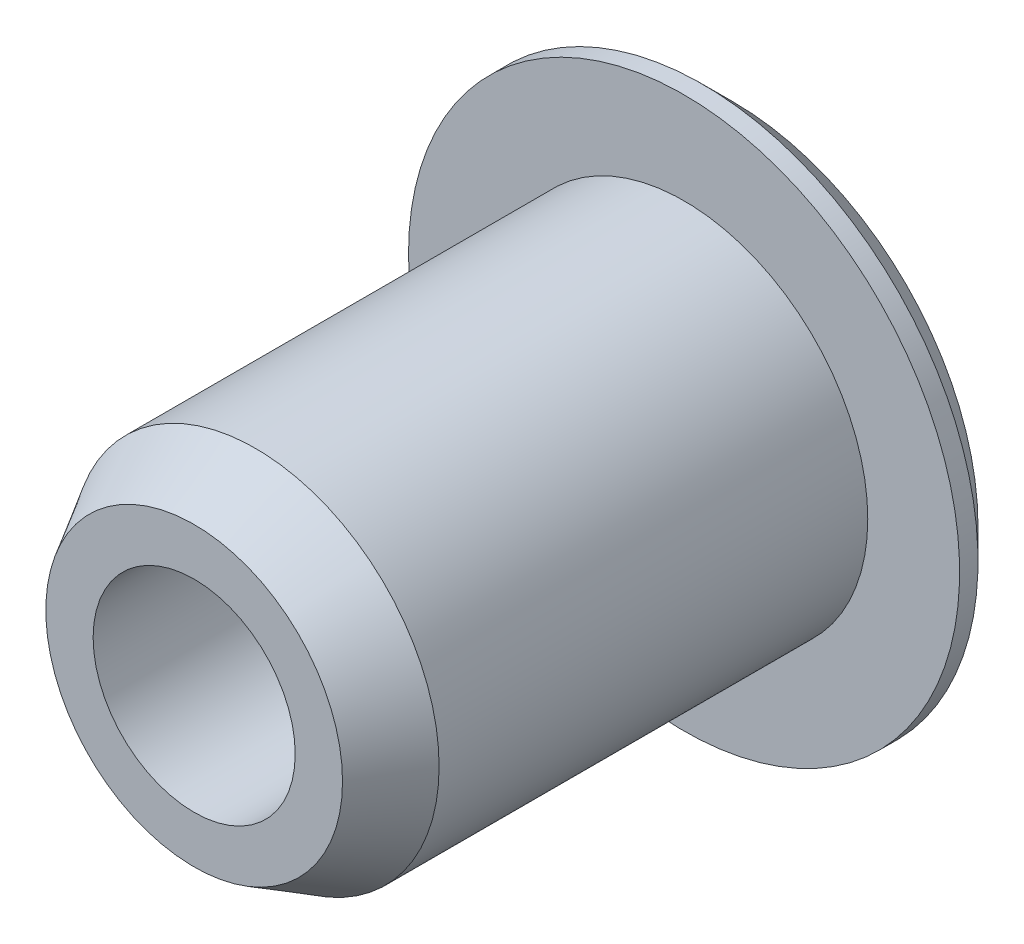
from build123d import *
from build123d.topology import SkipClean

# Parameters (mm, degrees)
SKETCH_1_R          = 3
SKETCH_1_R_2        = 1.65
EXTRUDE_1_DEPTH     = 8
EXTRUDE_START       = 0.8
SKETCH_2_R          = 4.5
SKETCH_2_R_2        = 1.65
EXTRUDE_2_DEPTH     = 0.8
SKETCH_3_R          = 2.2
CUT_EXTRUDE_1_DEPTH = 3
CHAMFER_1_SIZE      = 0.5
CHAMFER_2_SIZE      = 1
CHAMFER_2_SIZE2     = 0.577350269


with BuildPart() as part:
    # 草图1 → 凸台-拉伸1 (new body)
    with BuildSketch(Plane.XY):
        Circle(SKETCH_1_R)
        Circle(SKETCH_1_R_2, mode=Mode.SUBTRACT)
    extrude(amount=EXTRUDE_1_DEPTH)

    # 草图2 → 凸台-拉伸2 (add)
    with SkipClean():  # the faces are left unmerged after this step: merging them gives an invalid solid
        with BuildSketch(Plane(origin=(0, 0, 0), x_dir=(-1, 0, 0), z_dir=(0, 0, -1)).offset(EXTRUDE_START)):
            Circle(SKETCH_2_R)
            Circle(SKETCH_2_R_2, mode=Mode.SUBTRACT)
        extrude(amount=-EXTRUDE_2_DEPTH)

    # 草图3 → 切除-拉伸1 (cut)
    with BuildSketch(Plane(origin=(0, 0, -0.8), x_dir=(-1, 0, 0), z_dir=(0, 0, -1))):
        Circle(SKETCH_3_R)
    extrude(amount=-CUT_EXTRUDE_1_DEPTH, mode=Mode.SUBTRACT)

    # 倒角1
    chamfer_1_edges = [part.edges().sort_by_distance(p)[0] for p in [
        (4.5, 0, -0.8),
    ]]
    chamfer(chamfer_1_edges, length=CHAMFER_1_SIZE)

    # 倒角2
    chamfer_2_edges = [part.edges().sort_by_distance(p)[0] for p in [
        (-3, 0, 8),
    ]]
    chamfer_2_side = [part.faces().sort_by_distance(p)[0] for p in [
        (-3, 0, 4),
    ]]
    chamfer(chamfer_2_edges, length=CHAMFER_2_SIZE, length2=CHAMFER_2_SIZE2, reference=chamfer_2_side[0])


solid = part.part
